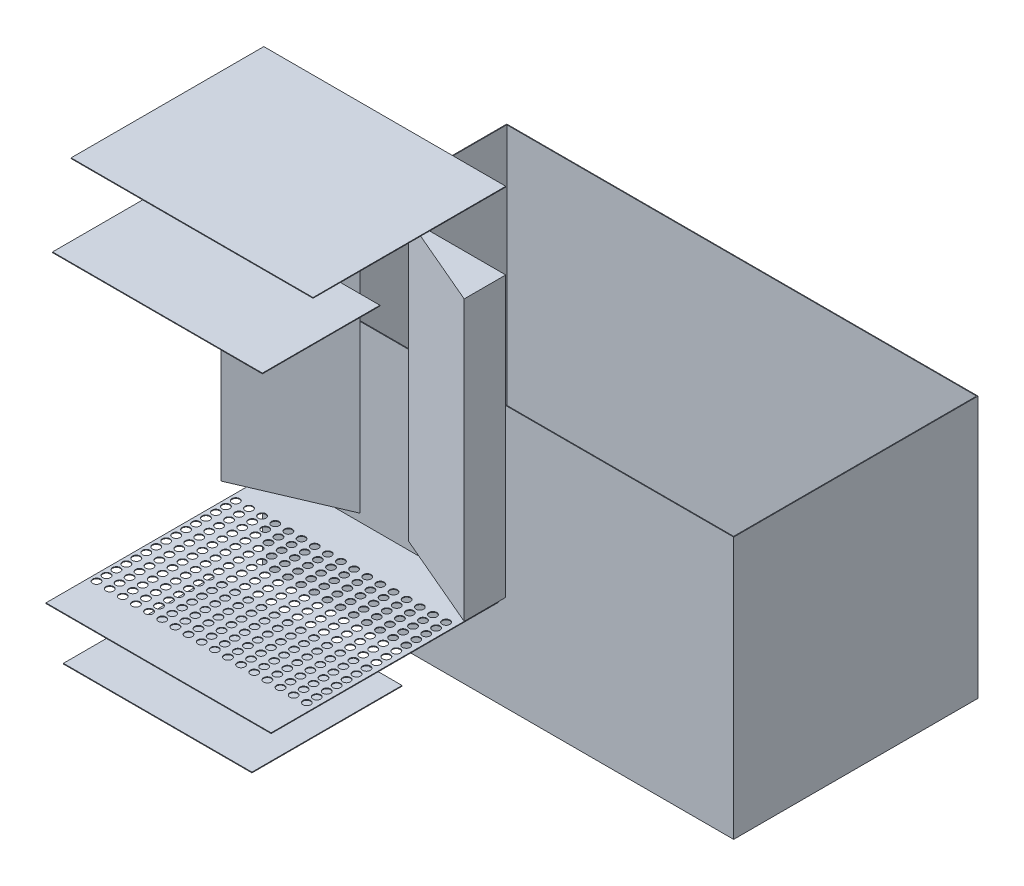
from build123d import *

# Parameters (mm, degrees)
MASTER_FOOTPRINT_W            = 1350
MASTER_FOOTPRINT_H            = 700
BATH_BASE_PLATE_DEPTH         = 750
BATH_SHELL_2MM_T              = -2
INLET_IMPACT_BAFFLE_START     = 125
SKETCH_1_W                    = 540
SKETCH_1_H                    = 430
INLET_IMPACT_BAFFLE_DEPTH     = 2
DISTRIBUTOR_D22_START         = 250
SKETCH_2_W                    = 645
SKETCH_2_H                    = 652
SKETCH_2_R                    = 11
DISTRIBUTOR_D22_DEPTH         = 2
OUTLET_SUBMERGED_BAFFLE_START = 1130
SKETCH_3_W                    = 601.176470588
SKETCH_3_H                    = 336.5
OUTLET_SUBMERGED_BAFFLE_DEPTH = 2
OVERFLOW_WEIR_Z550_START      = 1290
SKETCH_4_W                    = 693
SKETCH_4_H                    = 552
OVERFLOW_WEIR_Z550_DEPTH      = 2
SLOPED_SEDIMENT_FLOOR_START   = 275
SLOPED_SEDIMENT_FLOOR_DEPTH   = 800
SLOPED_SEDIMENT_FLOOR_2_DEPTH = 800


with BuildPart() as part:
    # MASTER_FOOTPRINT → BATH_BASE_PLATE (new body)
    with BuildSketch(Plane(origin=(0, 0, 0), x_dir=(1, 0, 0), z_dir=(0, 1, 0))):
        with Locations((675, 350)):
            Rectangle(MASTER_FOOTPRINT_W, MASTER_FOOTPRINT_H)
    extrude(amount=BATH_BASE_PLATE_DEPTH)

    # BATH_SHELL_2MM
    bath_shell_2mm_openings = [part.faces().sort_by_distance(p)[0] for p in [
        (675, 750, -350),
    ]]
    offset(amount=BATH_SHELL_2MM_T, openings=bath_shell_2mm_openings, kind=Kind.INTERSECTION)


with BuildPart() as body_2:
    # Эскиз1 → INLET_IMPACT_BAFFLE (new body)
    with BuildSketch(Plane(origin=(0, 0, 0), x_dir=(1, 0, 0), z_dir=(0, 1, 0)).offset(INLET_IMPACT_BAFFLE_START)):
        with Locations((350, -435)):
            Rectangle(SKETCH_1_W, SKETCH_1_H)
    extrude(amount=INLET_IMPACT_BAFFLE_DEPTH)


with BuildPart() as body_3:
    # Эскиз2 → DISTRIBUTOR_D22 (new body)
    with BuildSketch(Plane(origin=(0, 0, 0), x_dir=(1, 0, 0), z_dir=(0, 1, 0)).offset(DISTRIBUTOR_D22_START)):
        with Locations((352.5, -324)):
            Rectangle(SKETCH_2_W, SKETCH_2_H)
        with Locations(Location((48.823529412, -125, 0), (0, 0, 270))):
            Circle(SKETCH_2_R, mode=Mode.SUBTRACT)
        with Locations(Location((48.823529412, -153.5, 0), (0, 0, 270))):
            Circle(SKETCH_2_R, mode=Mode.SUBTRACT)
        with Locations(Location((48.823529412, -182, 0), (0, 0, 270))):
            Circle(SKETCH_2_R, mode=Mode.SUBTRACT)
        with Locations(Location((48.823529412, -210.5, 0), (0, 0, 270))):
            Circle(SKETCH_2_R, mode=Mode.SUBTRACT)
        with Locations(Location((48.823529412, -239, 0), (0, 0, 270))):
            Circle(SKETCH_2_R, mode=Mode.SUBTRACT)
        with Locations(Location((48.823529412, -267.5, 0), (0, 0, 270))):
            Circle(SKETCH_2_R, mode=Mode.SUBTRACT)
        with Locations(Location((48.823529412, -296, 0), (0, 0, 270))):
            Circle(SKETCH_2_R, mode=Mode.SUBTRACT)
        with Locations(Location((48.823529412, -324.5, 0), (0, 0, 270))):
            Circle(SKETCH_2_R, mode=Mode.SUBTRACT)
        with Locations(Location((48.823529412, -353, 0), (0, 0, 270))):
            Circle(SKETCH_2_R, mode=Mode.SUBTRACT)
        with Locations(Location((48.823529412, -381.5, 0), (0, 0, 270))):
            Circle(SKETCH_2_R, mode=Mode.SUBTRACT)
        with Locations(Location((48.823529412, -410, 0), (0, 0, 270))):
            Circle(SKETCH_2_R, mode=Mode.SUBTRACT)
        with Locations(Location((48.823529412, -438.5, 0), (0, 0, 270))):
            Circle(SKETCH_2_R, mode=Mode.SUBTRACT)
        with Locations(Location((48.823529412, -467, 0), (0, 0, 270))):
            Circle(SKETCH_2_R, mode=Mode.SUBTRACT)
        with Locations(Location((48.823529412, -495.5, 0), (0, 0, 270))):
            Circle(SKETCH_2_R, mode=Mode.SUBTRACT)
        with Locations(Location((48.823529412, -524, 0), (0, 0, 270))):
            Circle(SKETCH_2_R, mode=Mode.SUBTRACT)
        with Locations(Location((86.470588235, -125, 0), (0, 0, 270))):
            Circle(SKETCH_2_R, mode=Mode.SUBTRACT)
        with Locations(Location((86.470588235, -153.5, 0), (0, 0, 270))):
            Circle(SKETCH_2_R, mode=Mode.SUBTRACT)
        with Locations(Location((86.470588235, -182, 0), (0, 0, 270))):
            Circle(SKETCH_2_R, mode=Mode.SUBTRACT)
        with Locations(Location((86.470588235, -210.5, 0), (0, 0, 270))):
            Circle(SKETCH_2_R, mode=Mode.SUBTRACT)
        with Locations(Location((86.470588235, -239, 0), (0, 0, 270))):
            Circle(SKETCH_2_R, mode=Mode.SUBTRACT)
        with Locations(Location((86.470588235, -267.5, 0), (0, 0, 270))):
            Circle(SKETCH_2_R, mode=Mode.SUBTRACT)
        with Locations(Location((86.470588235, -296, 0), (0, 0, 270))):
            Circle(SKETCH_2_R, mode=Mode.SUBTRACT)
        with Locations(Location((86.470588235, -324.5, 0), (0, 0, 270))):
            Circle(SKETCH_2_R, mode=Mode.SUBTRACT)
        with Locations(Location((86.470588235, -353, 0), (0, 0, 270))):
            Circle(SKETCH_2_R, mode=Mode.SUBTRACT)
        with Locations(Location((86.470588235, -381.5, 0), (0, 0, 270))):
            Circle(SKETCH_2_R, mode=Mode.SUBTRACT)
        with Locations(Location((86.470588235, -410, 0), (0, 0, 270))):
            Circle(SKETCH_2_R, mode=Mode.SUBTRACT)
        with Locations(Location((86.470588235, -438.5, 0), (0, 0, 270))):
            Circle(SKETCH_2_R, mode=Mode.SUBTRACT)
        with Locations(Location((86.470588235, -467, 0), (0, 0, 270))):
            Circle(SKETCH_2_R, mode=Mode.SUBTRACT)
        with Locations(Location((86.470588235, -495.5, 0), (0, 0, 270))):
            Circle(SKETCH_2_R, mode=Mode.SUBTRACT)
        with Locations(Location((86.470588235, -524, 0), (0, 0, 270))):
            Circle(SKETCH_2_R, mode=Mode.SUBTRACT)
        with Locations(Location((124.117647059, -125, 0), (0, 0, 270))):
            Circle(SKETCH_2_R, mode=Mode.SUBTRACT)
        with Locations(Location((124.117647059, -153.5, 0), (0, 0, 270))):
            Circle(SKETCH_2_R, mode=Mode.SUBTRACT)
        with Locations(Location((124.117647059, -182, 0), (0, 0, 270))):
            Circle(SKETCH_2_R, mode=Mode.SUBTRACT)
        with Locations(Location((124.117647059, -210.5, 0), (0, 0, 270))):
            Circle(SKETCH_2_R, mode=Mode.SUBTRACT)
        with Locations(Location((124.117647059, -239, 0), (0, 0, 270))):
            Circle(SKETCH_2_R, mode=Mode.SUBTRACT)
        with Locations(Location((124.117647059, -267.5, 0), (0, 0, 270))):
            Circle(SKETCH_2_R, mode=Mode.SUBTRACT)
        with Locations(Location((124.117647059, -296, 0), (0, 0, 270))):
            Circle(SKETCH_2_R, mode=Mode.SUBTRACT)
        with Locations(Location((124.117647059, -324.5, 0), (0, 0, 270))):
            Circle(SKETCH_2_R, mode=Mode.SUBTRACT)
        with Locations(Location((124.117647059, -353, 0), (0, 0, 270))):
            Circle(SKETCH_2_R, mode=Mode.SUBTRACT)
        with Locations(Location((124.117647059, -381.5, 0), (0, 0, 270))):
            Circle(SKETCH_2_R, mode=Mode.SUBTRACT)
        with Locations(Location((124.117647059, -410, 0), (0, 0, 270))):
            Circle(SKETCH_2_R, mode=Mode.SUBTRACT)
        with Locations(Location((124.117647059, -438.5, 0), (0, 0, 270))):
            Circle(SKETCH_2_R, mode=Mode.SUBTRACT)
        with Locations(Location((124.117647059, -467, 0), (0, 0, 270))):
            Circle(SKETCH_2_R, mode=Mode.SUBTRACT)
        with Locations(Location((124.117647059, -495.5, 0), (0, 0, 270))):
            Circle(SKETCH_2_R, mode=Mode.SUBTRACT)
        with Locations(Location((124.117647059, -524, 0), (0, 0, 270))):
            Circle(SKETCH_2_R, mode=Mode.SUBTRACT)
        with Locations(Location((161.764705882, -125, 0), (0, 0, 270))):
            Circle(SKETCH_2_R, mode=Mode.SUBTRACT)
        with Locations(Location((161.764705882, -153.5, 0), (0, 0, 270))):
            Circle(SKETCH_2_R, mode=Mode.SUBTRACT)
        with Locations(Location((161.764705882, -182, 0), (0, 0, 270))):
            Circle(SKETCH_2_R, mode=Mode.SUBTRACT)
        with Locations(Location((161.764705882, -210.5, 0), (0, 0, 270))):
            Circle(SKETCH_2_R, mode=Mode.SUBTRACT)
        with Locations(Location((161.764705882, -239, 0), (0, 0, 270))):
            Circle(SKETCH_2_R, mode=Mode.SUBTRACT)
        with Locations(Location((161.764705882, -267.5, 0), (0, 0, 270))):
            Circle(SKETCH_2_R, mode=Mode.SUBTRACT)
        with Locations(Location((161.764705882, -296, 0), (0, 0, 270))):
            Circle(SKETCH_2_R, mode=Mode.SUBTRACT)
        with Locations(Location((161.764705882, -324.5, 0), (0, 0, 270))):
            Circle(SKETCH_2_R, mode=Mode.SUBTRACT)
        with Locations(Location((161.764705882, -353, 0), (0, 0, 270))):
            Circle(SKETCH_2_R, mode=Mode.SUBTRACT)
        with Locations(Location((161.764705882, -381.5, 0), (0, 0, 270))):
            Circle(SKETCH_2_R, mode=Mode.SUBTRACT)
        with Locations(Location((161.764705882, -410, 0), (0, 0, 270))):
            Circle(SKETCH_2_R, mode=Mode.SUBTRACT)
        with Locations(Location((161.764705882, -438.5, 0), (0, 0, 270))):
            Circle(SKETCH_2_R, mode=Mode.SUBTRACT)
        with Locations(Location((161.764705882, -467, 0), (0, 0, 270))):
            Circle(SKETCH_2_R, mode=Mode.SUBTRACT)
        with Locations(Location((161.764705882, -495.5, 0), (0, 0, 270))):
            Circle(SKETCH_2_R, mode=Mode.SUBTRACT)
        with Locations(Location((161.764705882, -524, 0), (0, 0, 270))):
            Circle(SKETCH_2_R, mode=Mode.SUBTRACT)
        with Locations(Location((199.411764706, -125, 0), (0, 0, 270))):
            Circle(SKETCH_2_R, mode=Mode.SUBTRACT)
        with Locations(Location((199.411764706, -153.5, 0), (0, 0, 270))):
            Circle(SKETCH_2_R, mode=Mode.SUBTRACT)
        with Locations(Location((199.411764706, -182, 0), (0, 0, 270))):
            Circle(SKETCH_2_R, mode=Mode.SUBTRACT)
        with Locations(Location((199.411764706, -210.5, 0), (0, 0, 270))):
            Circle(SKETCH_2_R, mode=Mode.SUBTRACT)
        with Locations(Location((199.411764706, -239, 0), (0, 0, 270))):
            Circle(SKETCH_2_R, mode=Mode.SUBTRACT)
        with Locations(Location((199.411764706, -267.5, 0), (0, 0, 270))):
            Circle(SKETCH_2_R, mode=Mode.SUBTRACT)
        with Locations(Location((199.411764706, -296, 0), (0, 0, 270))):
            Circle(SKETCH_2_R, mode=Mode.SUBTRACT)
        with Locations(Location((199.411764706, -324.5, 0), (0, 0, 270))):
            Circle(SKETCH_2_R, mode=Mode.SUBTRACT)
        with Locations(Location((199.411764706, -353, 0), (0, 0, 270))):
            Circle(SKETCH_2_R, mode=Mode.SUBTRACT)
        with Locations(Location((199.411764706, -381.5, 0), (0, 0, 270))):
            Circle(SKETCH_2_R, mode=Mode.SUBTRACT)
        with Locations(Location((199.411764706, -410, 0), (0, 0, 270))):
            Circle(SKETCH_2_R, mode=Mode.SUBTRACT)
        with Locations(Location((199.411764706, -438.5, 0), (0, 0, 270))):
            Circle(SKETCH_2_R, mode=Mode.SUBTRACT)
        with Locations(Location((199.411764706, -467, 0), (0, 0, 270))):
            Circle(SKETCH_2_R, mode=Mode.SUBTRACT)
        with Locations(Location((199.411764706, -495.5, 0), (0, 0, 270))):
            Circle(SKETCH_2_R, mode=Mode.SUBTRACT)
        with Locations(Location((199.411764706, -524, 0), (0, 0, 270))):
            Circle(SKETCH_2_R, mode=Mode.SUBTRACT)
        with Locations(Location((237.058823529, -125, 0), (0, 0, 270))):
            Circle(SKETCH_2_R, mode=Mode.SUBTRACT)
        with Locations(Location((237.058823529, -153.5, 0), (0, 0, 270))):
            Circle(SKETCH_2_R, mode=Mode.SUBTRACT)
        with Locations(Location((237.058823529, -182, 0), (0, 0, 270))):
            Circle(SKETCH_2_R, mode=Mode.SUBTRACT)
        with Locations(Location((237.058823529, -210.5, 0), (0, 0, 270))):
            Circle(SKETCH_2_R, mode=Mode.SUBTRACT)
        with Locations(Location((237.058823529, -239, 0), (0, 0, 270))):
            Circle(SKETCH_2_R, mode=Mode.SUBTRACT)
        with Locations(Location((237.058823529, -267.5, 0), (0, 0, 270))):
            Circle(SKETCH_2_R, mode=Mode.SUBTRACT)
        with Locations(Location((237.058823529, -296, 0), (0, 0, 270))):
            Circle(SKETCH_2_R, mode=Mode.SUBTRACT)
        with Locations(Location((237.058823529, -324.5, 0), (0, 0, 270))):
            Circle(SKETCH_2_R, mode=Mode.SUBTRACT)
        with Locations(Location((237.058823529, -353, 0), (0, 0, 270))):
            Circle(SKETCH_2_R, mode=Mode.SUBTRACT)
        with Locations(Location((237.058823529, -381.5, 0), (0, 0, 270))):
            Circle(SKETCH_2_R, mode=Mode.SUBTRACT)
        with Locations(Location((237.058823529, -410, 0), (0, 0, 270))):
            Circle(SKETCH_2_R, mode=Mode.SUBTRACT)
        with Locations(Location((237.058823529, -438.5, 0), (0, 0, 270))):
            Circle(SKETCH_2_R, mode=Mode.SUBTRACT)
        with Locations(Location((237.058823529, -467, 0), (0, 0, 270))):
            Circle(SKETCH_2_R, mode=Mode.SUBTRACT)
        with Locations(Location((237.058823529, -495.5, 0), (0, 0, 270))):
            Circle(SKETCH_2_R, mode=Mode.SUBTRACT)
        with Locations(Location((237.058823529, -524, 0), (0, 0, 270))):
            Circle(SKETCH_2_R, mode=Mode.SUBTRACT)
        with Locations(Location((274.705882353, -125, 0), (0, 0, 270))):
            Circle(SKETCH_2_R, mode=Mode.SUBTRACT)
        with Locations(Location((274.705882353, -153.5, 0), (0, 0, 270))):
            Circle(SKETCH_2_R, mode=Mode.SUBTRACT)
        with Locations(Location((274.705882353, -182, 0), (0, 0, 270))):
            Circle(SKETCH_2_R, mode=Mode.SUBTRACT)
        with Locations(Location((274.705882353, -210.5, 0), (0, 0, 270))):
            Circle(SKETCH_2_R, mode=Mode.SUBTRACT)
        with Locations(Location((274.705882353, -239, 0), (0, 0, 270))):
            Circle(SKETCH_2_R, mode=Mode.SUBTRACT)
        with Locations(Location((274.705882353, -267.5, 0), (0, 0, 270))):
            Circle(SKETCH_2_R, mode=Mode.SUBTRACT)
        with Locations(Location((274.705882353, -296, 0), (0, 0, 270))):
            Circle(SKETCH_2_R, mode=Mode.SUBTRACT)
        with Locations(Location((274.705882353, -324.5, 0), (0, 0, 270))):
            Circle(SKETCH_2_R, mode=Mode.SUBTRACT)
        with Locations(Location((274.705882353, -353, 0), (0, 0, 270))):
            Circle(SKETCH_2_R, mode=Mode.SUBTRACT)
        with Locations(Location((274.705882353, -381.5, 0), (0, 0, 270))):
            Circle(SKETCH_2_R, mode=Mode.SUBTRACT)
        with Locations(Location((274.705882353, -410, 0), (0, 0, 270))):
            Circle(SKETCH_2_R, mode=Mode.SUBTRACT)
        with Locations(Location((274.705882353, -438.5, 0), (0, 0, 270))):
            Circle(SKETCH_2_R, mode=Mode.SUBTRACT)
        with Locations(Location((274.705882353, -467, 0), (0, 0, 270))):
            Circle(SKETCH_2_R, mode=Mode.SUBTRACT)
        with Locations(Location((274.705882353, -495.5, 0), (0, 0, 270))):
            Circle(SKETCH_2_R, mode=Mode.SUBTRACT)
        with Locations(Location((274.705882353, -524, 0), (0, 0, 270))):
            Circle(SKETCH_2_R, mode=Mode.SUBTRACT)
        with Locations(Location((312.352941176, -125, 0), (0, 0, 270))):
            Circle(SKETCH_2_R, mode=Mode.SUBTRACT)
        with Locations(Location((312.352941176, -153.5, 0), (0, 0, 270))):
            Circle(SKETCH_2_R, mode=Mode.SUBTRACT)
        with Locations(Location((312.352941176, -182, 0), (0, 0, 270))):
            Circle(SKETCH_2_R, mode=Mode.SUBTRACT)
        with Locations(Location((312.352941176, -210.5, 0), (0, 0, 270))):
            Circle(SKETCH_2_R, mode=Mode.SUBTRACT)
        with Locations(Location((312.352941176, -239, 0), (0, 0, 270))):
            Circle(SKETCH_2_R, mode=Mode.SUBTRACT)
        with Locations(Location((312.352941176, -267.5, 0), (0, 0, 270))):
            Circle(SKETCH_2_R, mode=Mode.SUBTRACT)
        with Locations(Location((312.352941176, -296, 0), (0, 0, 270))):
            Circle(SKETCH_2_R, mode=Mode.SUBTRACT)
        with Locations(Location((312.352941176, -324.5, 0), (0, 0, 270))):
            Circle(SKETCH_2_R, mode=Mode.SUBTRACT)
        with Locations(Location((312.352941176, -353, 0), (0, 0, 270))):
            Circle(SKETCH_2_R, mode=Mode.SUBTRACT)
        with Locations(Location((312.352941176, -381.5, 0), (0, 0, 270))):
            Circle(SKETCH_2_R, mode=Mode.SUBTRACT)
        with Locations(Location((312.352941176, -410, 0), (0, 0, 270))):
            Circle(SKETCH_2_R, mode=Mode.SUBTRACT)
        with Locations(Location((312.352941176, -438.5, 0), (0, 0, 270))):
            Circle(SKETCH_2_R, mode=Mode.SUBTRACT)
        with Locations(Location((312.352941176, -467, 0), (0, 0, 270))):
            Circle(SKETCH_2_R, mode=Mode.SUBTRACT)
        with Locations(Location((312.352941176, -495.5, 0), (0, 0, 270))):
            Circle(SKETCH_2_R, mode=Mode.SUBTRACT)
        with Locations(Location((312.352941176, -524, 0), (0, 0, 270))):
            Circle(SKETCH_2_R, mode=Mode.SUBTRACT)
        with Locations(Location((350, -125, 0), (0, 0, 270))):
            Circle(SKETCH_2_R, mode=Mode.SUBTRACT)
        with Locations(Location((350, -153.5, 0), (0, 0, 270))):
            Circle(SKETCH_2_R, mode=Mode.SUBTRACT)
        with Locations(Location((350, -182, 0), (0, 0, 270))):
            Circle(SKETCH_2_R, mode=Mode.SUBTRACT)
        with Locations(Location((350, -210.5, 0), (0, 0, 270))):
            Circle(SKETCH_2_R, mode=Mode.SUBTRACT)
        with Locations(Location((350, -239, 0), (0, 0, 270))):
            Circle(SKETCH_2_R, mode=Mode.SUBTRACT)
        with Locations(Location((350, -267.5, 0), (0, 0, 270))):
            Circle(SKETCH_2_R, mode=Mode.SUBTRACT)
        with Locations(Location((350, -296, 0), (0, 0, 270))):
            Circle(SKETCH_2_R, mode=Mode.SUBTRACT)
        with Locations(Location((350, -324.5, 0), (0, 0, 270))):
            Circle(SKETCH_2_R, mode=Mode.SUBTRACT)
        with Locations(Location((350, -353, 0), (0, 0, 270))):
            Circle(SKETCH_2_R, mode=Mode.SUBTRACT)
        with Locations(Location((350, -381.5, 0), (0, 0, 270))):
            Circle(SKETCH_2_R, mode=Mode.SUBTRACT)
        with Locations(Location((350, -410, 0), (0, 0, 270))):
            Circle(SKETCH_2_R, mode=Mode.SUBTRACT)
        with Locations(Location((350, -438.5, 0), (0, 0, 270))):
            Circle(SKETCH_2_R, mode=Mode.SUBTRACT)
        with Locations(Location((350, -467, 0), (0, 0, 270))):
            Circle(SKETCH_2_R, mode=Mode.SUBTRACT)
        with Locations(Location((350, -495.5, 0), (0, 0, 270))):
            Circle(SKETCH_2_R, mode=Mode.SUBTRACT)
        with Locations(Location((350, -524, 0), (0, 0, 270))):
            Circle(SKETCH_2_R, mode=Mode.SUBTRACT)
        with Locations(Location((387.647058824, -125, 0), (0, 0, 270))):
            Circle(SKETCH_2_R, mode=Mode.SUBTRACT)
        with Locations(Location((387.647058824, -153.5, 0), (0, 0, 270))):
            Circle(SKETCH_2_R, mode=Mode.SUBTRACT)
        with Locations(Location((387.647058824, -182, 0), (0, 0, 270))):
            Circle(SKETCH_2_R, mode=Mode.SUBTRACT)
        with Locations(Location((387.647058824, -210.5, 0), (0, 0, 270))):
            Circle(SKETCH_2_R, mode=Mode.SUBTRACT)
        with Locations(Location((387.647058824, -239, 0), (0, 0, 270))):
            Circle(SKETCH_2_R, mode=Mode.SUBTRACT)
        with Locations(Location((387.647058824, -267.5, 0), (0, 0, 270))):
            Circle(SKETCH_2_R, mode=Mode.SUBTRACT)
        with Locations(Location((387.647058824, -296, 0), (0, 0, 270))):
            Circle(SKETCH_2_R, mode=Mode.SUBTRACT)
        with Locations(Location((387.647058824, -324.5, 0), (0, 0, 270))):
            Circle(SKETCH_2_R, mode=Mode.SUBTRACT)
        with Locations(Location((387.647058824, -353, 0), (0, 0, 270))):
            Circle(SKETCH_2_R, mode=Mode.SUBTRACT)
        with Locations(Location((387.647058824, -381.5, 0), (0, 0, 270))):
            Circle(SKETCH_2_R, mode=Mode.SUBTRACT)
        with Locations(Location((387.647058824, -410, 0), (0, 0, 270))):
            Circle(SKETCH_2_R, mode=Mode.SUBTRACT)
        with Locations(Location((387.647058824, -438.5, 0), (0, 0, 270))):
            Circle(SKETCH_2_R, mode=Mode.SUBTRACT)
        with Locations(Location((387.647058824, -467, 0), (0, 0, 270))):
            Circle(SKETCH_2_R, mode=Mode.SUBTRACT)
        with Locations(Location((387.647058824, -495.5, 0), (0, 0, 270))):
            Circle(SKETCH_2_R, mode=Mode.SUBTRACT)
        with Locations(Location((387.647058824, -524, 0), (0, 0, 270))):
            Circle(SKETCH_2_R, mode=Mode.SUBTRACT)
        with Locations(Location((425.294117647, -125, 0), (0, 0, 270))):
            Circle(SKETCH_2_R, mode=Mode.SUBTRACT)
        with Locations(Location((425.294117647, -153.5, 0), (0, 0, 270))):
            Circle(SKETCH_2_R, mode=Mode.SUBTRACT)
        with Locations(Location((425.294117647, -182, 0), (0, 0, 270))):
            Circle(SKETCH_2_R, mode=Mode.SUBTRACT)
        with Locations(Location((425.294117647, -210.5, 0), (0, 0, 270))):
            Circle(SKETCH_2_R, mode=Mode.SUBTRACT)
        with Locations(Location((425.294117647, -239, 0), (0, 0, 270))):
            Circle(SKETCH_2_R, mode=Mode.SUBTRACT)
        with Locations(Location((425.294117647, -267.5, 0), (0, 0, 270))):
            Circle(SKETCH_2_R, mode=Mode.SUBTRACT)
        with Locations(Location((425.294117647, -296, 0), (0, 0, 270))):
            Circle(SKETCH_2_R, mode=Mode.SUBTRACT)
        with Locations(Location((425.294117647, -324.5, 0), (0, 0, 270))):
            Circle(SKETCH_2_R, mode=Mode.SUBTRACT)
        with Locations(Location((425.294117647, -353, 0), (0, 0, 270))):
            Circle(SKETCH_2_R, mode=Mode.SUBTRACT)
        with Locations(Location((425.294117647, -381.5, 0), (0, 0, 270))):
            Circle(SKETCH_2_R, mode=Mode.SUBTRACT)
        with Locations(Location((425.294117647, -410, 0), (0, 0, 270))):
            Circle(SKETCH_2_R, mode=Mode.SUBTRACT)
        with Locations(Location((425.294117647, -438.5, 0), (0, 0, 270))):
            Circle(SKETCH_2_R, mode=Mode.SUBTRACT)
        with Locations(Location((425.294117647, -467, 0), (0, 0, 270))):
            Circle(SKETCH_2_R, mode=Mode.SUBTRACT)
        with Locations(Location((425.294117647, -495.5, 0), (0, 0, 270))):
            Circle(SKETCH_2_R, mode=Mode.SUBTRACT)
        with Locations(Location((425.294117647, -524, 0), (0, 0, 270))):
            Circle(SKETCH_2_R, mode=Mode.SUBTRACT)
        with Locations(Location((462.941176471, -125, 0), (0, 0, 270))):
            Circle(SKETCH_2_R, mode=Mode.SUBTRACT)
        with Locations(Location((462.941176471, -153.5, 0), (0, 0, 270))):
            Circle(SKETCH_2_R, mode=Mode.SUBTRACT)
        with Locations(Location((462.941176471, -182, 0), (0, 0, 270))):
            Circle(SKETCH_2_R, mode=Mode.SUBTRACT)
        with Locations(Location((462.941176471, -210.5, 0), (0, 0, 270))):
            Circle(SKETCH_2_R, mode=Mode.SUBTRACT)
        with Locations(Location((462.941176471, -239, 0), (0, 0, 270))):
            Circle(SKETCH_2_R, mode=Mode.SUBTRACT)
        with Locations(Location((462.941176471, -267.5, 0), (0, 0, 270))):
            Circle(SKETCH_2_R, mode=Mode.SUBTRACT)
        with Locations(Location((462.941176471, -296, 0), (0, 0, 270))):
            Circle(SKETCH_2_R, mode=Mode.SUBTRACT)
        with Locations(Location((462.941176471, -324.5, 0), (0, 0, 270))):
            Circle(SKETCH_2_R, mode=Mode.SUBTRACT)
        with Locations(Location((462.941176471, -353, 0), (0, 0, 270))):
            Circle(SKETCH_2_R, mode=Mode.SUBTRACT)
        with Locations(Location((462.941176471, -381.5, 0), (0, 0, 270))):
            Circle(SKETCH_2_R, mode=Mode.SUBTRACT)
        with Locations(Location((462.941176471, -410, 0), (0, 0, 270))):
            Circle(SKETCH_2_R, mode=Mode.SUBTRACT)
        with Locations(Location((462.941176471, -438.5, 0), (0, 0, 270))):
            Circle(SKETCH_2_R, mode=Mode.SUBTRACT)
        with Locations(Location((462.941176471, -467, 0), (0, 0, 270))):
            Circle(SKETCH_2_R, mode=Mode.SUBTRACT)
        with Locations(Location((462.941176471, -495.5, 0), (0, 0, 270))):
            Circle(SKETCH_2_R, mode=Mode.SUBTRACT)
        with Locations(Location((462.941176471, -524, 0), (0, 0, 270))):
            Circle(SKETCH_2_R, mode=Mode.SUBTRACT)
        with Locations(Location((500.588235294, -125, 0), (0, 0, 270))):
            Circle(SKETCH_2_R, mode=Mode.SUBTRACT)
        with Locations(Location((500.588235294, -153.5, 0), (0, 0, 270))):
            Circle(SKETCH_2_R, mode=Mode.SUBTRACT)
        with Locations(Location((500.588235294, -182, 0), (0, 0, 270))):
            Circle(SKETCH_2_R, mode=Mode.SUBTRACT)
        with Locations(Location((500.588235294, -210.5, 0), (0, 0, 270))):
            Circle(SKETCH_2_R, mode=Mode.SUBTRACT)
        with Locations(Location((500.588235294, -239, 0), (0, 0, 270))):
            Circle(SKETCH_2_R, mode=Mode.SUBTRACT)
        with Locations(Location((500.588235294, -267.5, 0), (0, 0, 270))):
            Circle(SKETCH_2_R, mode=Mode.SUBTRACT)
        with Locations(Location((500.588235294, -296, 0), (0, 0, 270))):
            Circle(SKETCH_2_R, mode=Mode.SUBTRACT)
        with Locations(Location((500.588235294, -324.5, 0), (0, 0, 270))):
            Circle(SKETCH_2_R, mode=Mode.SUBTRACT)
        with Locations(Location((500.588235294, -353, 0), (0, 0, 270))):
            Circle(SKETCH_2_R, mode=Mode.SUBTRACT)
        with Locations(Location((500.588235294, -381.5, 0), (0, 0, 270))):
            Circle(SKETCH_2_R, mode=Mode.SUBTRACT)
        with Locations(Location((500.588235294, -410, 0), (0, 0, 270))):
            Circle(SKETCH_2_R, mode=Mode.SUBTRACT)
        with Locations(Location((500.588235294, -438.5, 0), (0, 0, 270))):
            Circle(SKETCH_2_R, mode=Mode.SUBTRACT)
        with Locations(Location((500.588235294, -467, 0), (0, 0, 270))):
            Circle(SKETCH_2_R, mode=Mode.SUBTRACT)
        with Locations(Location((500.588235294, -495.5, 0), (0, 0, 270))):
            Circle(SKETCH_2_R, mode=Mode.SUBTRACT)
        with Locations(Location((500.588235294, -524, 0), (0, 0, 270))):
            Circle(SKETCH_2_R, mode=Mode.SUBTRACT)
        with Locations(Location((538.235294118, -125, 0), (0, 0, 270))):
            Circle(SKETCH_2_R, mode=Mode.SUBTRACT)
        with Locations(Location((538.235294118, -153.5, 0), (0, 0, 270))):
            Circle(SKETCH_2_R, mode=Mode.SUBTRACT)
        with Locations(Location((538.235294118, -182, 0), (0, 0, 270))):
            Circle(SKETCH_2_R, mode=Mode.SUBTRACT)
        with Locations(Location((538.235294118, -210.5, 0), (0, 0, 270))):
            Circle(SKETCH_2_R, mode=Mode.SUBTRACT)
        with Locations(Location((538.235294118, -239, 0), (0, 0, 270))):
            Circle(SKETCH_2_R, mode=Mode.SUBTRACT)
        with Locations(Location((538.235294118, -267.5, 0), (0, 0, 270))):
            Circle(SKETCH_2_R, mode=Mode.SUBTRACT)
        with Locations(Location((538.235294118, -296, 0), (0, 0, 270))):
            Circle(SKETCH_2_R, mode=Mode.SUBTRACT)
        with Locations(Location((538.235294118, -324.5, 0), (0, 0, 270))):
            Circle(SKETCH_2_R, mode=Mode.SUBTRACT)
        with Locations(Location((538.235294118, -353, 0), (0, 0, 270))):
            Circle(SKETCH_2_R, mode=Mode.SUBTRACT)
        with Locations(Location((538.235294118, -381.5, 0), (0, 0, 270))):
            Circle(SKETCH_2_R, mode=Mode.SUBTRACT)
        with Locations(Location((538.235294118, -410, 0), (0, 0, 270))):
            Circle(SKETCH_2_R, mode=Mode.SUBTRACT)
        with Locations(Location((538.235294118, -438.5, 0), (0, 0, 270))):
            Circle(SKETCH_2_R, mode=Mode.SUBTRACT)
        with Locations(Location((538.235294118, -467, 0), (0, 0, 270))):
            Circle(SKETCH_2_R, mode=Mode.SUBTRACT)
        with Locations(Location((538.235294118, -495.5, 0), (0, 0, 270))):
            Circle(SKETCH_2_R, mode=Mode.SUBTRACT)
        with Locations(Location((538.235294118, -524, 0), (0, 0, 270))):
            Circle(SKETCH_2_R, mode=Mode.SUBTRACT)
        with Locations(Location((575.882352941, -125, 0), (0, 0, 270))):
            Circle(SKETCH_2_R, mode=Mode.SUBTRACT)
        with Locations(Location((575.882352941, -153.5, 0), (0, 0, 270))):
            Circle(SKETCH_2_R, mode=Mode.SUBTRACT)
        with Locations(Location((575.882352941, -182, 0), (0, 0, 270))):
            Circle(SKETCH_2_R, mode=Mode.SUBTRACT)
        with Locations(Location((575.882352941, -210.5, 0), (0, 0, 270))):
            Circle(SKETCH_2_R, mode=Mode.SUBTRACT)
        with Locations(Location((575.882352941, -239, 0), (0, 0, 270))):
            Circle(SKETCH_2_R, mode=Mode.SUBTRACT)
        with Locations(Location((575.882352941, -267.5, 0), (0, 0, 270))):
            Circle(SKETCH_2_R, mode=Mode.SUBTRACT)
        with Locations(Location((575.882352941, -296, 0), (0, 0, 270))):
            Circle(SKETCH_2_R, mode=Mode.SUBTRACT)
        with Locations(Location((575.882352941, -324.5, 0), (0, 0, 270))):
            Circle(SKETCH_2_R, mode=Mode.SUBTRACT)
        with Locations(Location((575.882352941, -353, 0), (0, 0, 270))):
            Circle(SKETCH_2_R, mode=Mode.SUBTRACT)
        with Locations(Location((575.882352941, -381.5, 0), (0, 0, 270))):
            Circle(SKETCH_2_R, mode=Mode.SUBTRACT)
        with Locations(Location((575.882352941, -410, 0), (0, 0, 270))):
            Circle(SKETCH_2_R, mode=Mode.SUBTRACT)
        with Locations(Location((575.882352941, -438.5, 0), (0, 0, 270))):
            Circle(SKETCH_2_R, mode=Mode.SUBTRACT)
        with Locations(Location((575.882352941, -467, 0), (0, 0, 270))):
            Circle(SKETCH_2_R, mode=Mode.SUBTRACT)
        with Locations(Location((575.882352941, -495.5, 0), (0, 0, 270))):
            Circle(SKETCH_2_R, mode=Mode.SUBTRACT)
        with Locations(Location((575.882352941, -524, 0), (0, 0, 270))):
            Circle(SKETCH_2_R, mode=Mode.SUBTRACT)
        with Locations(Location((613.529411765, -125, 0), (0, 0, 270))):
            Circle(SKETCH_2_R, mode=Mode.SUBTRACT)
        with Locations(Location((613.529411765, -153.5, 0), (0, 0, 270))):
            Circle(SKETCH_2_R, mode=Mode.SUBTRACT)
        with Locations(Location((613.529411765, -182, 0), (0, 0, 270))):
            Circle(SKETCH_2_R, mode=Mode.SUBTRACT)
        with Locations(Location((613.529411765, -210.5, 0), (0, 0, 270))):
            Circle(SKETCH_2_R, mode=Mode.SUBTRACT)
        with Locations(Location((613.529411765, -239, 0), (0, 0, 270))):
            Circle(SKETCH_2_R, mode=Mode.SUBTRACT)
        with Locations(Location((613.529411765, -267.5, 0), (0, 0, 270))):
            Circle(SKETCH_2_R, mode=Mode.SUBTRACT)
        with Locations(Location((613.529411765, -296, 0), (0, 0, 270))):
            Circle(SKETCH_2_R, mode=Mode.SUBTRACT)
        with Locations(Location((613.529411765, -324.5, 0), (0, 0, 270))):
            Circle(SKETCH_2_R, mode=Mode.SUBTRACT)
        with Locations(Location((613.529411765, -353, 0), (0, 0, 270))):
            Circle(SKETCH_2_R, mode=Mode.SUBTRACT)
        with Locations(Location((613.529411765, -381.5, 0), (0, 0, 270))):
            Circle(SKETCH_2_R, mode=Mode.SUBTRACT)
        with Locations(Location((613.529411765, -410, 0), (0, 0, 270))):
            Circle(SKETCH_2_R, mode=Mode.SUBTRACT)
        with Locations(Location((613.529411765, -438.5, 0), (0, 0, 270))):
            Circle(SKETCH_2_R, mode=Mode.SUBTRACT)
        with Locations(Location((613.529411765, -467, 0), (0, 0, 270))):
            Circle(SKETCH_2_R, mode=Mode.SUBTRACT)
        with Locations(Location((613.529411765, -495.5, 0), (0, 0, 270))):
            Circle(SKETCH_2_R, mode=Mode.SUBTRACT)
        with Locations(Location((613.529411765, -524, 0), (0, 0, 270))):
            Circle(SKETCH_2_R, mode=Mode.SUBTRACT)
        with Locations(Location((651.176470588, -125, 0), (0, 0, 270))):
            Circle(SKETCH_2_R, mode=Mode.SUBTRACT)
        with Locations(Location((651.176470588, -153.5, 0), (0, 0, 270))):
            Circle(SKETCH_2_R, mode=Mode.SUBTRACT)
        with Locations(Location((651.176470588, -182, 0), (0, 0, 270))):
            Circle(SKETCH_2_R, mode=Mode.SUBTRACT)
        with Locations(Location((651.176470588, -210.5, 0), (0, 0, 270))):
            Circle(SKETCH_2_R, mode=Mode.SUBTRACT)
        with Locations(Location((651.176470588, -239, 0), (0, 0, 270))):
            Circle(SKETCH_2_R, mode=Mode.SUBTRACT)
        with Locations(Location((651.176470588, -267.5, 0), (0, 0, 270))):
            Circle(SKETCH_2_R, mode=Mode.SUBTRACT)
        with Locations(Location((651.176470588, -296, 0), (0, 0, 270))):
            Circle(SKETCH_2_R, mode=Mode.SUBTRACT)
        with Locations(Location((651.176470588, -324.5, 0), (0, 0, 270))):
            Circle(SKETCH_2_R, mode=Mode.SUBTRACT)
        with Locations(Location((651.176470588, -353, 0), (0, 0, 270))):
            Circle(SKETCH_2_R, mode=Mode.SUBTRACT)
        with Locations(Location((651.176470588, -381.5, 0), (0, 0, 270))):
            Circle(SKETCH_2_R, mode=Mode.SUBTRACT)
        with Locations(Location((651.176470588, -410, 0), (0, 0, 270))):
            Circle(SKETCH_2_R, mode=Mode.SUBTRACT)
        with Locations(Location((651.176470588, -438.5, 0), (0, 0, 270))):
            Circle(SKETCH_2_R, mode=Mode.SUBTRACT)
        with Locations(Location((651.176470588, -467, 0), (0, 0, 270))):
            Circle(SKETCH_2_R, mode=Mode.SUBTRACT)
        with Locations(Location((651.176470588, -495.5, 0), (0, 0, 270))):
            Circle(SKETCH_2_R, mode=Mode.SUBTRACT)
        with Locations(Location((651.176470588, -524, 0), (0, 0, 270))):
            Circle(SKETCH_2_R, mode=Mode.SUBTRACT)
    extrude(amount=DISTRIBUTOR_D22_DEPTH)


with BuildPart() as body_4:
    # Эскиз3 → OUTLET_SUBMERGED_BAFFLE (new body)
    with BuildSketch(Plane(origin=(0, 0, 0), x_dir=(1, 0, 0), z_dir=(0, 1, 0)).offset(OUTLET_SUBMERGED_BAFFLE_START)):
        with Locations((349.411764706, -481.75)):
            Rectangle(SKETCH_3_W, SKETCH_3_H)
    extrude(amount=OUTLET_SUBMERGED_BAFFLE_DEPTH)


with BuildPart() as body_5:
    # Эскиз4 → OVERFLOW_WEIR_Z550 (new body)
    with BuildSketch(Plane(origin=(0, 0, 0), x_dir=(1, 0, 0), z_dir=(0, 1, 0)).offset(OVERFLOW_WEIR_Z550_START)):
        with Locations((348.5, -274)):
            Rectangle(SKETCH_4_W, SKETCH_4_H)
    extrude(amount=OVERFLOW_WEIR_Z550_DEPTH)


with BuildPart() as body_6:
    # Эскиз5 → SLOPED_SEDIMENT_FLOOR (new body)
    with BuildSketch(Plane(origin=(0, 0, 0), x_dir=(1, 0, 0), z_dir=(0, 1, 0)).offset(SLOPED_SEDIMENT_FLOOR_START)):
        Polygon((2, -1), (2, -120), (280, -1), align=None)
    extrude(amount=SLOPED_SEDIMENT_FLOOR_DEPTH)


with BuildPart() as body_7:
    # Эскиз5 → SLOPED_SEDIMENT_FLOOR 2 (new body)
    with BuildSketch(Plane(origin=(0, 0, 0), x_dir=(1, 0, 0), z_dir=(0, 1, 0)).offset(SLOPED_SEDIMENT_FLOOR_START)):
        Polygon((698, -1), (698, -120), (420, -1), align=None)
    extrude(amount=SLOPED_SEDIMENT_FLOOR_2_DEPTH)


solid = Compound([part.part, body_2.part, body_3.part, body_4.part, body_5.part, body_6.part, body_7.part])
